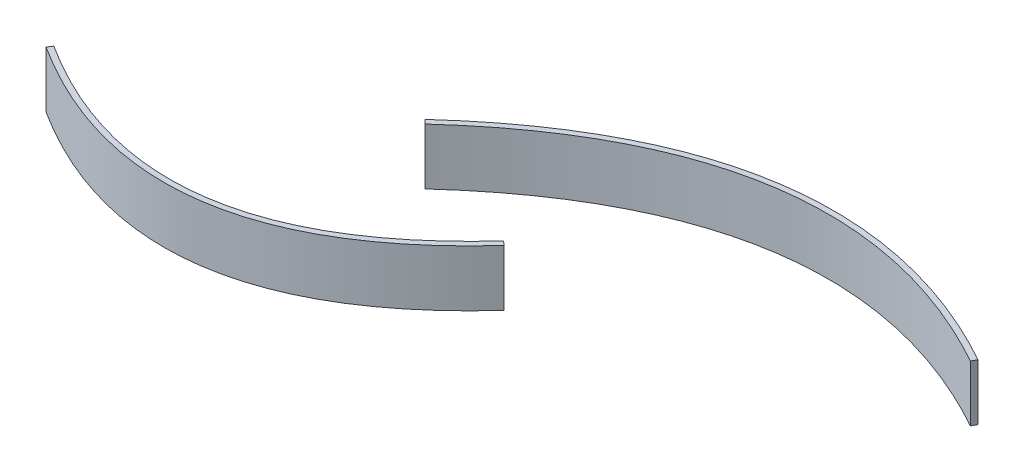
from build123d import *

# Parameters (mm, degrees)
BOSS_EXTRUDE1_DEPTH   = 100
BOSS_EXTRUDE1_2_DEPTH = 100


with BuildPart() as part:
    # Sketch2 → Boss-Extrude1 (new body)
    with BuildSketch(Plane(origin=(0, 0, 0), x_dir=(1, 0, 0), z_dir=(0, 1, 0))):
        with BuildLine():
            Line((374.628296099, 501.56526247), (380, 510))
            add(Edge.make_bspline(
                [(380, 510), (765.648450942, 264.39789551), (1080, 610)],
                knots=[0, 0, 0, 1, 1, 1], degree=2))
            Line((1080, 610), (1087.397612531, 603.271305562))
            add(Edge.make_bspline(
                [(374.628296099, 501.56526247), (376.652675637, 500.276026448), (380.720758418, 497.707701121), (388.824052603, 492.681835618), (398.942317337, 486.574959139), (411.051084523, 479.537732392), (427.157724343, 470.539431247), (447.216750526, 460.014930368), (471.170377074, 448.544102414), (495.00718599, 438.233929118), (526.634300022, 426.037434745), (565.877106852, 413.704742254), (612.497099343, 403.587039941), (658.630861524, 398.171948108), (704.254057326, 397.476841105), (749.334719328, 401.511344411), (793.837699559, 410.274498162), (837.730363716, 423.754574124), (880.987503579, 441.931705096), (923.593867321, 464.782175641), (958.552261081, 487.699165006), (986.192007845, 508.347722138), (1006.759175925, 524.989578308), (1027.16474126, 542.78511594), (1044.035543065, 558.574716154), (1057.452856135, 571.782145535), (1067.475484342, 581.974522934), (1075.797092179, 590.710277834), (1082.429557002, 597.836888743), (1085.748674507, 601.458442056), (1087.397612531, 603.271305562)],
                knots=[0, 0, 0, 0, 0.0078125, 0.015625, 0.03125, 0.046875, 0.0625, 0.09375, 0.125, 0.15625, 0.1875, 0.25, 0.3125, 0.375, 0.4375, 0.5, 0.5625, 0.625, 0.6875, 0.75, 0.8125, 0.84375, 0.875, 0.90625, 0.9375, 0.953125, 0.96875, 0.984375, 0.9921875, 1, 1, 1, 1], degree=3))
        make_face()
    extrude(amount=BOSS_EXTRUDE1_DEPTH)


with BuildPart() as body_2:
    # Sketch2 → Boss-Extrude1 2 (new body)
    with BuildSketch(Plane(origin=(0, 0, 0), x_dir=(1, 0, 0), z_dir=(0, 1, 0))):
        with BuildLine():
            Line((830, 720), (823.262365385, 727.389470873))
            add(Edge.make_bspline(
                [(823.262365385, 727.389470873), (825.377734768, 729.318240365), (829.630063139, 733.168595845), (838.122239016, 740.750423493), (848.759608615, 750.046280333), (861.545710334, 760.897913291), (878.627388595, 774.966720203), (900.040277479, 791.800263599), (925.834434109, 810.796263839), (951.727686534, 828.586703778), (986.38483586, 850.698218528), (1029.956163663, 875.317057992), (1082.641689062, 900.013755812), (1135.722774479, 919.850002265), (1189.189830591, 934.811271327), (1243.027898668, 944.88492735), (1297.217585695, 950.062239621), (1351.737032302, 950.339907388), (1406.564505345, 945.720596556), (1461.680943023, 936.212298146), (1507.839912968, 924.224368531), (1544.899631683, 912.202195037), (1572.760050482, 901.971377888), (1600.685726671, 890.528013045), (1624.011214556, 879.982841334), (1642.704475786, 870.941814647), (1656.739924063, 863.859308904), (1668.452347873, 857.704094065), (1677.824680307, 852.632223036), (1682.524162963, 850.040099617), (1684.864495478, 848.737086685)],
                knots=[0, 0, 0, 0, 0.0078125, 0.015625, 0.03125, 0.046875, 0.0625, 0.09375, 0.125, 0.15625, 0.1875, 0.25, 0.3125, 0.375, 0.4375, 0.5, 0.5625, 0.625, 0.6875, 0.75, 0.8125, 0.84375, 0.875, 0.90625, 0.9375, 0.953125, 0.96875, 0.984375, 0.9921875, 1, 1, 1, 1], degree=3))
            Line((1684.864495478, 848.737086685), (1680, 840))
            add(Edge.make_bspline(
                [(830, 720), (1233.968809208, 1088.334117434), (1680, 840)],
                knots=[0, 0, 0, 1, 1, 1], degree=2))
        make_face()
    extrude(amount=BOSS_EXTRUDE1_2_DEPTH)


solid = Compound([part.part, body_2.part])
